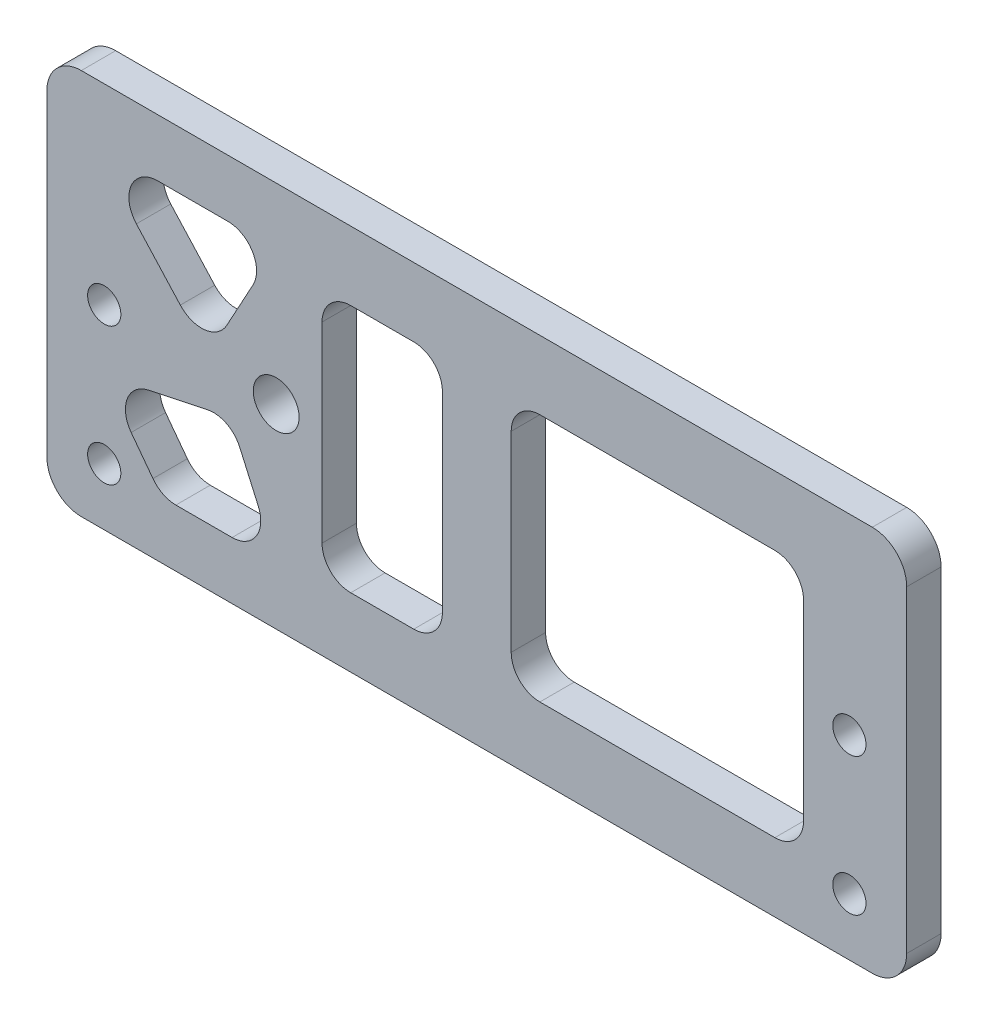
from build123d import *

# Parameters (mm, degrees)
SKETCH_1_W          = 75
SKETCH_1_H          = 33.7
SKETCH_1_R          = 1.45
SKETCH_1_R_2        = 2
EXTRUDE_1_DEPTH     = 3
SKETCH_2_W          = 25.5
SKETCH_2_H          = 21.7
SKETCH_2_W_2        = 10.5
CUT_EXTRUDE_1_DEPTH = 10
FILLET_1_R          = 2.5
FILLET_2_R          = 3


with BuildPart() as part:
    # 草图1 → 凸台-拉伸1 (new body)
    with BuildSketch(Plane.XY):
        with Locations((37.5, 16.85)):
            Rectangle(SKETCH_1_W, SKETCH_1_H)
        with Locations((5, 17)):
            Circle(SKETCH_1_R, mode=Mode.SUBTRACT)
        with Locations((5, 5)):
            Circle(SKETCH_1_R, mode=Mode.SUBTRACT)
        with Locations((70, 17)):
            Circle(SKETCH_1_R, mode=Mode.SUBTRACT)
        with Locations((70, 5)):
            Circle(SKETCH_1_R, mode=Mode.SUBTRACT)
        with Locations((20, 17)):
            Circle(SKETCH_1_R_2, mode=Mode.SUBTRACT)
    extrude(amount=EXTRUDE_1_DEPTH)

    # 草图2 → 切除-拉伸1 (cut)
    with BuildSketch(Plane.XY.offset(3)):
        Polygon((4, 28.7), (20, 28.7), (14, 17.7), align=None)
        with Locations((53.25, 16.85)):
            Rectangle(SKETCH_2_W, SKETCH_2_H)
        with Locations((29.25, 16.85)):
            Rectangle(SKETCH_2_W_2, SKETCH_2_H)
        Polygon((5, 11.666666667), (16, 14), (20, 5), (10, 5), align=None)
    extrude(amount=-CUT_EXTRUDE_1_DEPTH, mode=Mode.SUBTRACT)

    # 圆角1
    fillet_1_edges = [part.edges().sort_by_distance(p)[0] for p in [
        (40.5, 6, 1.5),
        (40.5, 27.7, 1.5),
        (66, 27.7, 1.5),
        (66, 6, 1.5),
        (10, 5, 1.5),
        (5, 11.666666667, 1.5),
        (16, 14, 1.5),
        (20, 5, 1.5),
        (14, 17.7, 1.5),
        (4, 28.7, 1.5),
        (20, 28.7, 1.5),
        (24, 6, 1.5),
        (24, 27.7, 1.5),
        (34.5, 27.7, 1.5),
        (34.5, 6, 1.5),
    ]]
    fillet(fillet_1_edges, radius=FILLET_1_R)

    # 圆角2
    fillet_2_edges = [part.edges().sort_by_distance(p)[0] for p in [
        (0, 33.7, 1.5),
        (75, 33.7, 1.5),
        (75, 0, 1.5),
        (0, 0, 1.5),
    ]]
    fillet(fillet_2_edges, radius=FILLET_2_R)


solid = part.part
